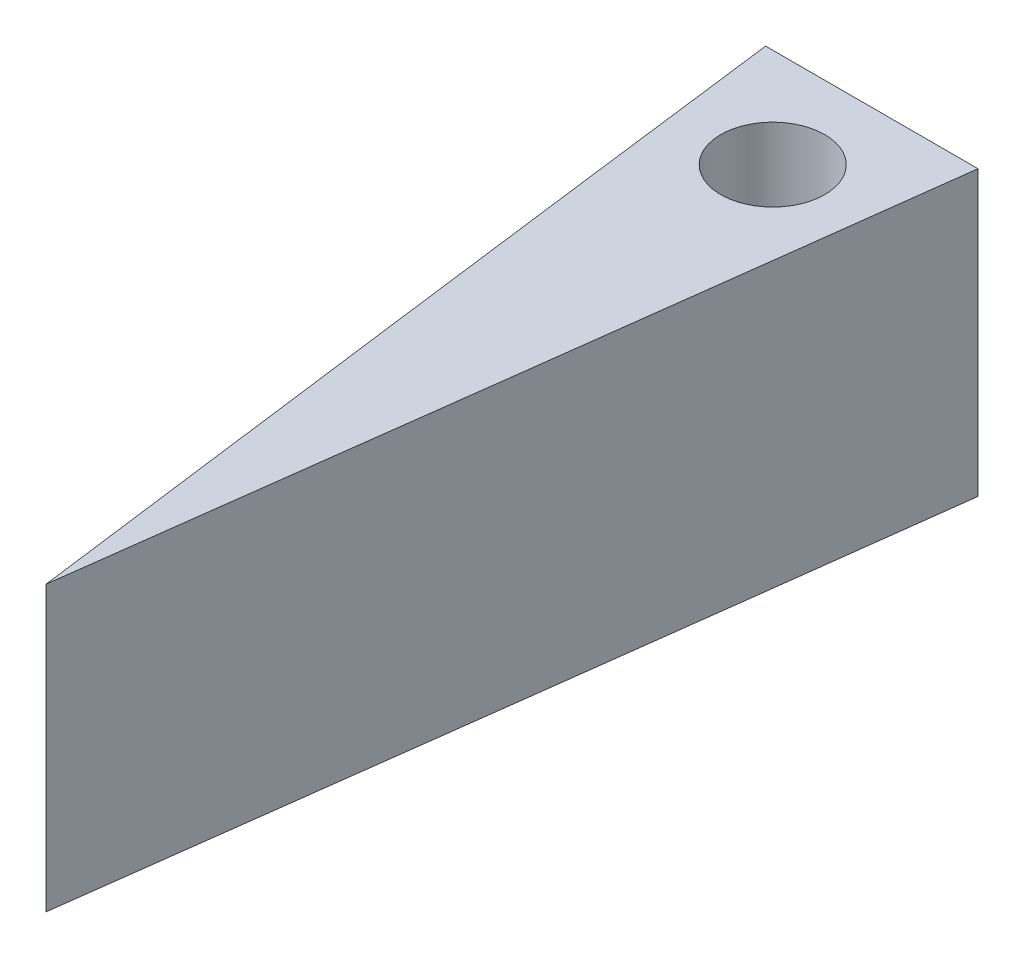
from build123d import *

# Parameters (mm, degrees)
SKETCH1_R               = 1.984375
BOSS_EXTRUDE1_DEPTH     = 169.87266
SKETCH2_W               = 35.763807095
SKETCH2_H               = 22.705005105
CUT_EXTRUDE1_DEPTH      = 23.05812
CUT_EXTRUDE2_START      = -169.87266
SKETCH2_2_W             = 35.763807095
SKETCH2_2_H             = 22.705005105
CUT_EXTRUDE2_DEPTH      = 23.05812
FILLET1_R               = 7.62
CUT_EXTRUDE3_DEPTH      = 198.390942599
CUT_EXTRUDE3_DEPTH_BACK = 198.390942599
SKETCH6_R               = 2
CUT_EXTRUDE4_DEPTH      = 198.390942599
CUT_EXTRUDE4_DEPTH_BACK = 198.390942599
SKETCH7_W               = 96.266326783
SKETCH7_H               = 154.195082356
SKETCH7_H_2             = 4.765737644
CUT_EXTRUDE5_DEPTH      = 101.887240685
CUT_EXTRUDE5_DEPTH_BACK = 101.887240685
SKETCH8_W               = 55.334278697
SKETCH8_H               = 41.811321678


with BuildPart() as part:
    # Sketch1 → Boss-Extrude1 (new body)
    with BuildSketch(Plane(origin=(0, 0, 0), x_dir=(1, 0, 0), z_dir=(0, 1, 0))):
        with BuildLine():
            Line((-9.955287346, -3.607451573), (-6.769721368, -3.607451573))
            Line((-6.769721368, -3.607451573), (8.985913589, -3.607451573))
            Line((8.985913589, -3.607451573), (12.171479568, -3.607451573))
            add(Edge.make_bspline(
                [(10.60289965, -20.752451573), (11.099968974, -15.730201571), (11.630563617, -10.016003166), (12.113997871, -4.296816952), (12.171479568, -3.607451573)],
                knots=[0.384969626, 0.384969626, 0.384969626, 0.384969626, 0.458108671, 0.468131593, 0.468131593, 0.468131593, 0.468131593], degree=3))
            add(Edge.make_bspline(
                [(1.108096111, -99.873778356), (4.527344744, -73.531764163), (7.9865599, -47.187219652), (10.60289965, -20.752451573)],
                knots=[0, 0, 0, 0, 0.384969626, 0.384969626, 0.384969626, 0.384969626], degree=3))
            add(Edge.make_bspline(
                [(1.108096111, -99.873778356), (-2.311152522, -73.531764163), (-5.770367679, -47.187219652), (-8.386707429, -20.752451573)],
                knots=[0, 0, 0, 0, 0.384969626, 0.384969626, 0.384969626, 0.384969626], degree=3))
            add(Edge.make_bspline(
                [(-8.386707429, -20.752451573), (-8.883776753, -15.730201571), (-9.414371396, -10.016003166), (-9.89780565, -4.296816952), (-9.955287346, -3.607451573)],
                knots=[0.384969626, 0.384969626, 0.384969626, 0.384969626, 0.458108671, 0.468131593, 0.468131593, 0.468131593, 0.468131593], degree=3))
        make_face()
        with Locations(Location((1.108108569, -11.326456678, 0), (0, 0, 270))):
            Circle(SKETCH1_R, mode=Mode.SUBTRACT)
    extrude(amount=BOSS_EXTRUDE1_DEPTH)

    # Sketch2 → Cut-Extrude1 (cut)
    with BuildSketch(Plane(origin=(0, 169.87266, 0), x_dir=(1, 0, 0), z_dir=(0, 1, 0))):
        with Locations((7.926616202, -14.959954125)):
            Rectangle(SKETCH2_W, SKETCH2_H)
    extrude(amount=-CUT_EXTRUDE1_DEPTH, mode=Mode.SUBTRACT)

    # Sketch2<2> → Cut-Extrude2 (cut)
    with BuildSketch(Plane(origin=(0, 169.87266, 0), x_dir=(1, 0, 0), z_dir=(0, 1, 0)).offset(CUT_EXTRUDE2_START)):
        with Locations((7.926616202, -14.959954125)):
            Rectangle(SKETCH2_2_W, SKETCH2_2_H)
    extrude(amount=CUT_EXTRUDE2_DEPTH, mode=Mode.SUBTRACT)

    # Fillet1
    fillet1_edges = [part.edges().sort_by_distance(p)[0] for p in [
        (-7.824155374, 11.52906, 26.312456678),
        (10.040347595, 11.52906, 26.312456678),
        (-9.955287346, 84.93633, 3.607451573),
        (12.171479568, 84.93633, 3.607451573),
        (-7.824155374, 158.3436, 26.312456678),
        (10.040347595, 158.3436, 26.312456678),
    ]]
    fillet(fillet1_edges, radius=FILLET1_R)

    # Sketch6 → Cut-Extrude3 (cut, two sides: drawn at the far end of the back side and taken through both)
    with BuildSketch(Plane.XZ.offset(-CUT_EXTRUDE3_DEPTH_BACK)):
        with Locations(Location((1.108096111, 71.933778356, 0), (0, 0, 270))):
            Circle(SKETCH6_R)
        with Locations(Location((1.108096111, 34.760552137, 0), (0, 0, 270))):
            Circle(SKETCH6_R)
    extrude(amount=CUT_EXTRUDE3_DEPTH + CUT_EXTRUDE3_DEPTH_BACK, mode=Mode.SUBTRACT)

    # Sketch7 → Cut-Extrude4 (cut, two sides: drawn at the far end of the back side and taken through both)
    with BuildSketch(Plane(origin=(0, 0, 0), x_dir=(0, 0, -1), z_dir=(1, 0, 0)).offset(-CUT_EXTRUDE4_DEPTH_BACK)):
        with Locations((-51.740614965, 77.097541178)):
            Rectangle(SKETCH7_W, SKETCH7_H)
        with Locations((-51.740614965, 167.489791178)):
            Rectangle(SKETCH7_W, SKETCH7_H_2)
    extrude(amount=CUT_EXTRUDE4_DEPTH + CUT_EXTRUDE4_DEPTH_BACK, mode=Mode.SUBTRACT)

    # Sketch8 → Cut-Extrude5 (cut, two sides: drawn at the far end of the back side and taken through both)
    with BuildSketch(Plane.XZ.offset(-154.195082356).offset(-CUT_EXTRUDE5_DEPTH_BACK)):
        with Locations((-8.071043379, 47.218117517)):
            Rectangle(SKETCH8_W, SKETCH8_H)
    extrude(amount=CUT_EXTRUDE5_DEPTH + CUT_EXTRUDE5_DEPTH_BACK, mode=Mode.SUBTRACT)


solid = part.part
